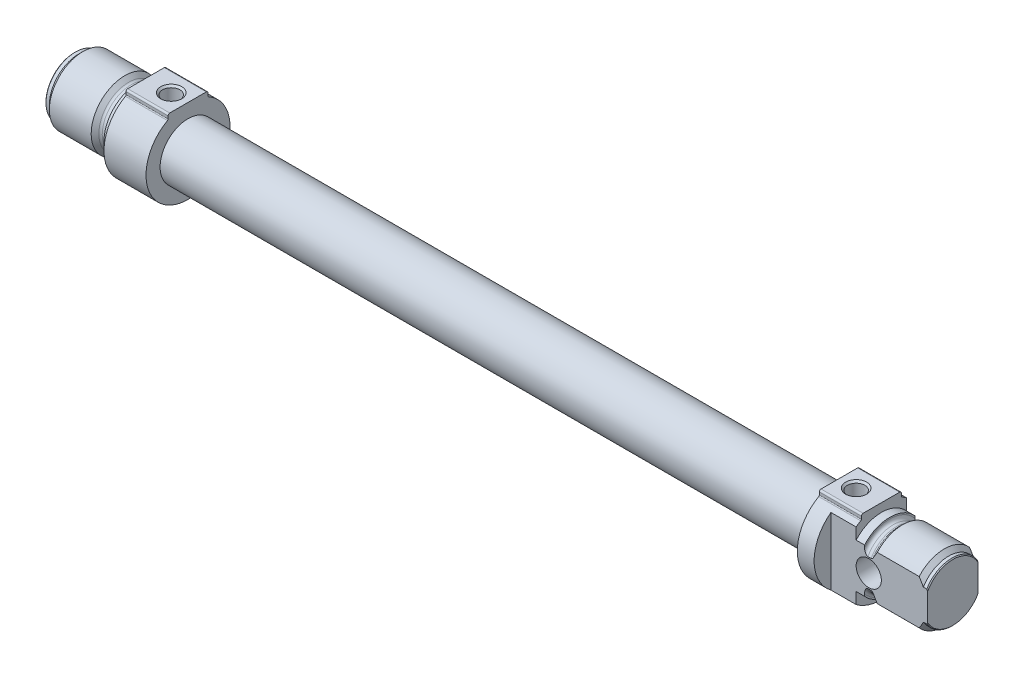
from build123d import *

# Parameters (mm, degrees)
AUFSATZ_LINEAR_AUSTRAGEN1_DEPTH      = 10
SKIZZE3_W                            = 155
SKIZZE3_H                            = 6.65
AUFSATZ_LINEAR_AUSTRAGEN2_DEPTH      = 10
SCHNITT_LINEAR_AUSTRAGEN1_DEPTH      = 10
SCHNITT_LINEAR_AUSTRAGEN1_DEPTH_BACK = 10
BOHRUNG1_D                           = 6
BOHRUNG2_D                           = 4.134
BOHRUNG2_DEPTH                       = 10
BOHRUNG2_CSINK_D                     = 5
BOHRUNG2_CSINK_ANGLE                 = 90
BOHRUNG3_D                           = 4.134
BOHRUNG3_DEPTH                       = 11
BOHRUNG3_CSINK_D                     = 5
BOHRUNG3_CSINK_ANGLE                 = 90
BOHRUNG3_TIP                         = 1.193383006


with BuildPart() as part:
    # Skizze1 → Rotation1 (revolve)
    with BuildSketch(Plane.XY, mode=Mode.PRIVATE) as rotation1_sk:
        with BuildLine():
            Line((0, 0), (0, 6.8))
            Line((0, 6.8), (0.2, 7))
            Line((0.2, 7), (1, 7))
            Line((1, 7), (2, 8))
            Line((2, 8), (11.95, 8))
            Line((11.95, 8), (12.865685425, 7.084314575))
            ThreePointArc((12.865685425, 7.084314575), (13.125224104, 6.910896374), (13.43137085, 6.85))
            Line((13.43137085, 6.85), (14.2, 6.85))
            ThreePointArc((14.2, 6.85), (14.765685425, 7.084314575), (15, 7.65))
            Line((15, 7.65), (15, 8))
            Line((15, 8), (17, 8))
            Line((17, 8), (17, 0))
            Line((17, 0), (0, 0))
        make_face()
    revolve(rotation1_sk.sketch.rotate(Axis((17, 0, 0), (-1, 0, 0)), 270), axis=Axis((17, 0, 0), (-1, 0, 0)))

    # Skizze2 → Aufsatz-Linear austragen1 (add)
    with BuildSketch(Plane(origin=(17, 0, 0), x_dir=(0, 0, -1), z_dir=(1, 0, 0))):
        with BuildLine():
            Line((4.75, 8.977054082), (4.75, 9.6))
            ThreePointArc((4.75, 9.6), (4.632842712, 9.882842712), (4.35, 10))
            Line((4.35, 10), (-4.35, 10))
            ThreePointArc((-4.35, 10), (-4.632842712, 9.882842712), (-4.75, 9.6))
            Line((-4.75, 9.6), (-4.75, 8.977054082))
            ThreePointArc((-4.75, 8.977054082), (-4.791034545, 8.825604773), (-4.902912621, 8.715586488))
            ThreePointArc((-4.902912621, 8.715586488), (0, -10), (4.902912621, 8.715586488))
            ThreePointArc((4.902912621, 8.715586488), (4.791034545, 8.825604773), (4.75, 8.977054082))
        make_face()
    extrude(amount=AUFSATZ_LINEAR_AUSTRAGEN1_DEPTH)

    # Skizze3 → Rotation2 (revolve)
    with BuildSketch(Plane.XY, mode=Mode.PRIVATE) as rotation2_sk:
        with Locations((104.5, 3.325)):
            Rectangle(SKIZZE3_W, SKIZZE3_H)
    revolve(rotation2_sk.sketch.rotate(Axis((182, 0, 0), (-1, 0, 0)), 270), axis=Axis((182, 0, 0), (-1, 0, 0)))

    # Skizze4 → Aufsatz-Linear austragen2 (add)
    with BuildSketch(Plane(origin=(182, 0, 0), x_dir=(0, 0, -1), z_dir=(1, 0, 0))):
        with BuildLine():
            Line((4.75, 8.977054082), (4.75, 9.6))
            ThreePointArc((4.75, 9.6), (4.632842712, 9.882842712), (4.35, 10))
            Line((4.35, 10), (-4.35, 10))
            ThreePointArc((-4.35, 10), (-4.632842712, 9.882842712), (-4.75, 9.6))
            Line((-4.75, 9.6), (-4.75, 8.977054082))
            ThreePointArc((-4.75, 8.977054082), (-4.791034545, 8.825604773), (-4.902912621, 8.715586488))
            ThreePointArc((-4.902912621, 8.715586488), (0, -10), (4.902912621, 8.715586488))
            ThreePointArc((4.902912621, 8.715586488), (4.791034545, 8.825604773), (4.75, 8.977054082))
        make_face()
    extrude(amount=AUFSATZ_LINEAR_AUSTRAGEN2_DEPTH)

    # Skizze5 → Rotation3 (revolve)
    with BuildSketch(Plane.XY, mode=Mode.PRIVATE) as rotation3_sk:
        with BuildLine():
            Line((192, 0), (192, 8))
            Line((192, 8), (194, 8))
            Line((194, 8), (194, 7.65))
            ThreePointArc((194, 7.65), (194.234314575, 7.084314575), (194.8, 6.85))
            Line((194.8, 6.85), (195.56862915, 6.85))
            ThreePointArc((195.56862915, 6.85), (195.874775896, 6.910896374), (196.134314575, 7.084314575))
            Line((196.134314575, 7.084314575), (197.05, 8))
            Line((197.05, 8), (207, 8))
            Line((207, 8), (208, 7))
            Line((208, 7), (208.8, 7))
            Line((208.8, 7), (209, 6.8))
            Line((209, 6.8), (209, 0))
            Line((209, 0), (192, 0))
        make_face()
    revolve(rotation3_sk.sketch.rotate(Axis((209, 0, 0), (-1, 0, 0)), 270), axis=Axis((209, 0, 0), (-1, 0, 0)))

    # Skizze6 → Schnitt-Linear austragen1 (cut, two sides: drawn at the far end of the back side and taken through both)
    with BuildSketch(Plane(origin=(0, 0, 0), x_dir=(1, 0, 0), z_dir=(0, 1, 0)).offset(-SCHNITT_LINEAR_AUSTRAGEN1_DEPTH_BACK)):
        Polygon((186, 18), (186, 6), (209, 6), (209, -6), (186, -6), (186, -18), (221, -18), (221, 18), align=None)
    extrude(amount=SCHNITT_LINEAR_AUSTRAGEN1_DEPTH + SCHNITT_LINEAR_AUSTRAGEN1_DEPTH_BACK, mode=Mode.SUBTRACT)

    # Bohrung1 (through all)
    with Locations(Plane(origin=(0, 0, -6), x_dir=(-1, 0, 0), z_dir=(0, 0, -1))):
        with Locations((-195, 0)):
            Hole(BOHRUNG1_D / 2)

    # Bohrung2
    with Locations(Plane(origin=(0, 10, 0), x_dir=(1, 0, 0), z_dir=(0, 1, 0))):
        with Locations((23, 0)):
            CounterSinkHole(BOHRUNG2_D / 2, BOHRUNG2_CSINK_D / 2, depth=BOHRUNG2_DEPTH, counter_sink_angle=BOHRUNG2_CSINK_ANGLE)

    # Bohrung3
    with Locations(Plane(origin=(0, 10, 0), x_dir=(1, 0, 0), z_dir=(0, 1, 0))):
        with Locations((186, 0)):
            CounterSinkHole(BOHRUNG3_D / 2, BOHRUNG3_CSINK_D / 2, depth=BOHRUNG3_DEPTH, counter_sink_angle=BOHRUNG3_CSINK_ANGLE)
            with Locations((0, 0, -(BOHRUNG3_DEPTH + BOHRUNG3_TIP / 2))):  # 120° drill point
                Cone(0, BOHRUNG3_D / 2, BOHRUNG3_TIP, mode=Mode.SUBTRACT)

    # Skizze13 → Schnitt-Rotation1 (revolve, cut)
    with BuildSketch(Plane.XY, mode=Mode.PRIVATE) as schnitt_rotation1_sk:
        Polygon((-5, 0), (-5, 3), (37.3, 3), (37.3, 6), (165.3, 6), (165.3, 0), align=None)
    revolve(schnitt_rotation1_sk.sketch.rotate(Axis((165.3, 0, 0), (-1, 0, 0)), 270), axis=Axis((165.3, 0, 0), (-1, 0, 0)), mode=Mode.SUBTRACT)


solid = part.part
